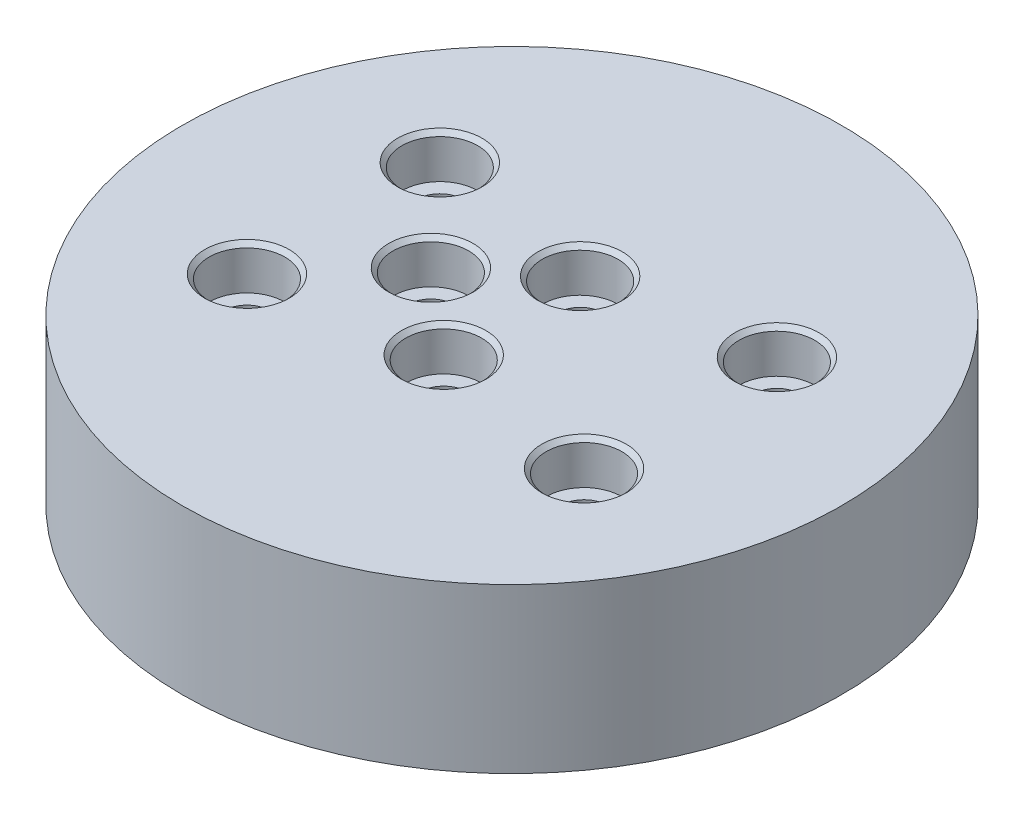
from build123d import *

# Parameters (mm, degrees)
SKETCH1_R                                     = 48.312804733
BOSS_EXTRUDE1_DEPTH                           = 24
CBORE_FOR_1_4_SOCKET_HEAD_CAP_SCREW1_AT_COUNT = 2
CBORE_FOR_1_4_SOCKET_HEAD_CAP_SCREW1_AT_PITCH = 25.050748534
CBORE_FOR_1_4_SOCKET_HEAD_CAP_SCREW1_2_COUNT  = 2
CBORE_FOR_1_4_SOCKET_HEAD_CAP_SCREW1_2_PITCH  = 34.539958202
CBORE_FOR_1_4_SOCKET_HEAD_CAP_SCREW1_3_COUNT  = 2
CBORE_FOR_1_4_SOCKET_HEAD_CAP_SCREW1_3_PITCH  = 34.539958202
CBORE_FOR_1_4_SOCKET_HEAD_CAP_SCREW1_4_COUNT  = 2
CBORE_FOR_1_4_SOCKET_HEAD_CAP_SCREW1_4_PITCH  = 20
CBORE_FOR_1_4_SOCKET_HEAD_CAP_SCREW1_5_COUNT  = 2
CBORE_FOR_1_4_SOCKET_HEAD_CAP_SCREW1_5_PITCH  = 25.050748534
CBORE_FOR_1_4_SOCKET_HEAD_CAP_SCREW1_6_COUNT  = 2
CBORE_FOR_1_4_SOCKET_HEAD_CAP_SCREW1_6_PITCH  = 15.698328502


with BuildPart() as part:
    # Sketch1 → Boss-Extrude1 (new body)
    with BuildSketch(Plane(origin=(0, 0, 0), x_dir=(1, 0, 0), z_dir=(0, 1, 0))):
        with Locations(Location((0, 0, 0), (0, 0, 270))):
            Circle(SKETCH1_R)
    extrude(amount=BOSS_EXTRUDE1_DEPTH)

    # Sketch3 → CBORE for 1/4 Socket Head Cap Screw1 (revolve, cut)
    with BuildSketch(Plane(origin=(0, 24, 10), x_dir=(0, 0, 1), z_dir=(1, 0, 0))):
        Polygon((0, 0), (0, 24), (3.3782, 24), (3.3782, 6.35), (5.55625, 6.35), (5.55625, 0.635), (6.19125, 0), align=None)
    cbore_for_1_4_socket_head_cap_screw1 = revolve(axis=Axis((0, 30.35, 10), (0, -1, 0)), mode=Mode.SUBTRACT)

    # CBORE for 1/4 Socket Head Cap Screw1 at: CBORE for 1/4 Socket Head Cap Screw1 ×2
    with Locations(*[Vector(-0.9862712240770178, 0, 0.16513349919874187) * (i * CBORE_FOR_1_4_SOCKET_HEAD_CAP_SCREW1_AT_PITCH) for i in range(1, CBORE_FOR_1_4_SOCKET_HEAD_CAP_SCREW1_AT_COUNT)]):
        add(cbore_for_1_4_socket_head_cap_screw1, mode=Mode.SUBTRACT)

    # CBORE for 1_4 Socket Head Cap Screw1 2: CBORE for 1/4 Socket Head Cap Screw1 ×2
    with Locations(*[Vector(-0.7153115900071431, 0, -0.6988056447979316) * (i * CBORE_FOR_1_4_SOCKET_HEAD_CAP_SCREW1_2_PITCH) for i in range(1, CBORE_FOR_1_4_SOCKET_HEAD_CAP_SCREW1_2_COUNT)]):
        add(cbore_for_1_4_socket_head_cap_screw1, mode=Mode.SUBTRACT)

    # CBORE for 1_4 Socket Head Cap Screw1 3: CBORE for 1/4 Socket Head Cap Screw1 ×2
    with Locations(*[Vector(0.7153115900071431, 0, -0.6988056447979316) * (i * CBORE_FOR_1_4_SOCKET_HEAD_CAP_SCREW1_3_PITCH) for i in range(1, CBORE_FOR_1_4_SOCKET_HEAD_CAP_SCREW1_3_COUNT)]):
        add(cbore_for_1_4_socket_head_cap_screw1, mode=Mode.SUBTRACT)

    # CBORE for 1_4 Socket Head Cap Screw1 4: CBORE for 1/4 Socket Head Cap Screw1 ×2
    with Locations(*[(0, 0, -i * CBORE_FOR_1_4_SOCKET_HEAD_CAP_SCREW1_4_PITCH) for i in range(1, CBORE_FOR_1_4_SOCKET_HEAD_CAP_SCREW1_4_COUNT)]):
        add(cbore_for_1_4_socket_head_cap_screw1, mode=Mode.SUBTRACT)

    # CBORE for 1_4 Socket Head Cap Screw1 5: CBORE for 1/4 Socket Head Cap Screw1 ×2
    with Locations(*[Vector(0.9862712240770178, 0, 0.16513349919874187) * (i * CBORE_FOR_1_4_SOCKET_HEAD_CAP_SCREW1_5_PITCH) for i in range(1, CBORE_FOR_1_4_SOCKET_HEAD_CAP_SCREW1_5_COUNT)]):
        add(cbore_for_1_4_socket_head_cap_screw1, mode=Mode.SUBTRACT)

    # CBORE for 1_4 Socket Head Cap Screw1 6: CBORE for 1/4 Socket Head Cap Screw1 ×2
    with Locations(*[Vector(-0.7644125932390737, 0, -0.6447273743975157) * (i * CBORE_FOR_1_4_SOCKET_HEAD_CAP_SCREW1_6_PITCH) for i in range(1, CBORE_FOR_1_4_SOCKET_HEAD_CAP_SCREW1_6_COUNT)]):
        add(cbore_for_1_4_socket_head_cap_screw1, mode=Mode.SUBTRACT)


solid = part.part
